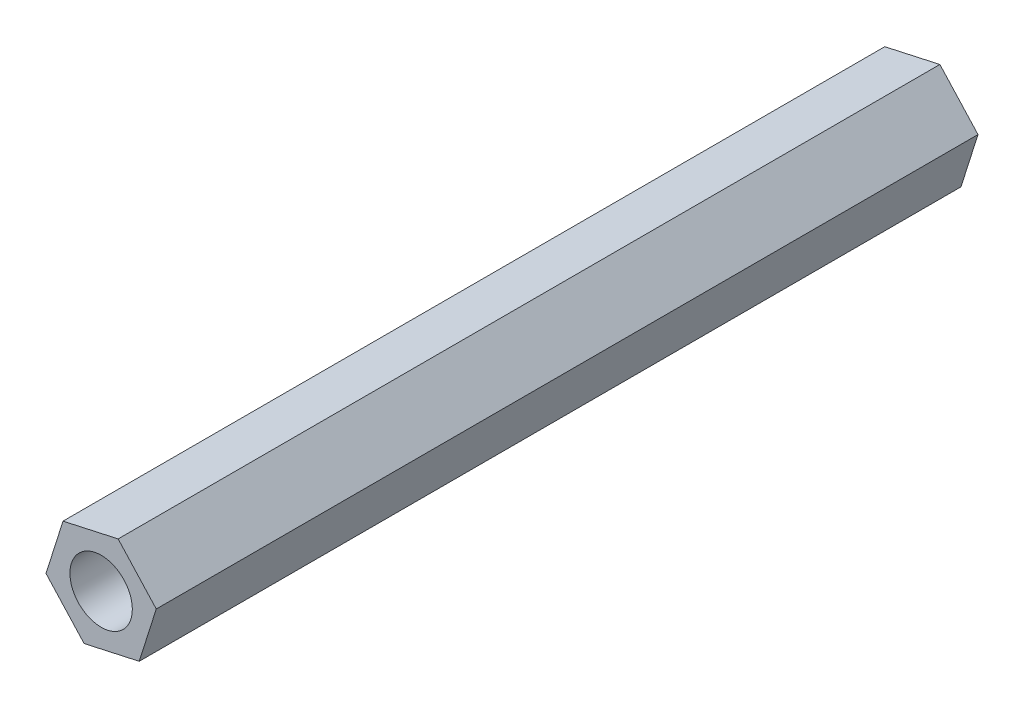
from build123d import *

# Parameters (mm, degrees)
SKETCH_1_R      = 1.5
EXTRUDE_1_DEPTH = 39.5


with BuildPart() as part:
    # 草图1 → 凸台-拉伸1 (new body)
    with BuildSketch(Plane.XY):
        Polygon((2.649803949, 0.584698524), (0.818538199, 2.587146797), (-1.83126575, 2.002448273), (-2.649803949, -0.584698524), (-0.818538199, -2.587146797), (1.83126575, -2.002448273), align=None)
        Circle(SKETCH_1_R, mode=Mode.SUBTRACT)
    extrude(amount=EXTRUDE_1_DEPTH)


solid = part.part
